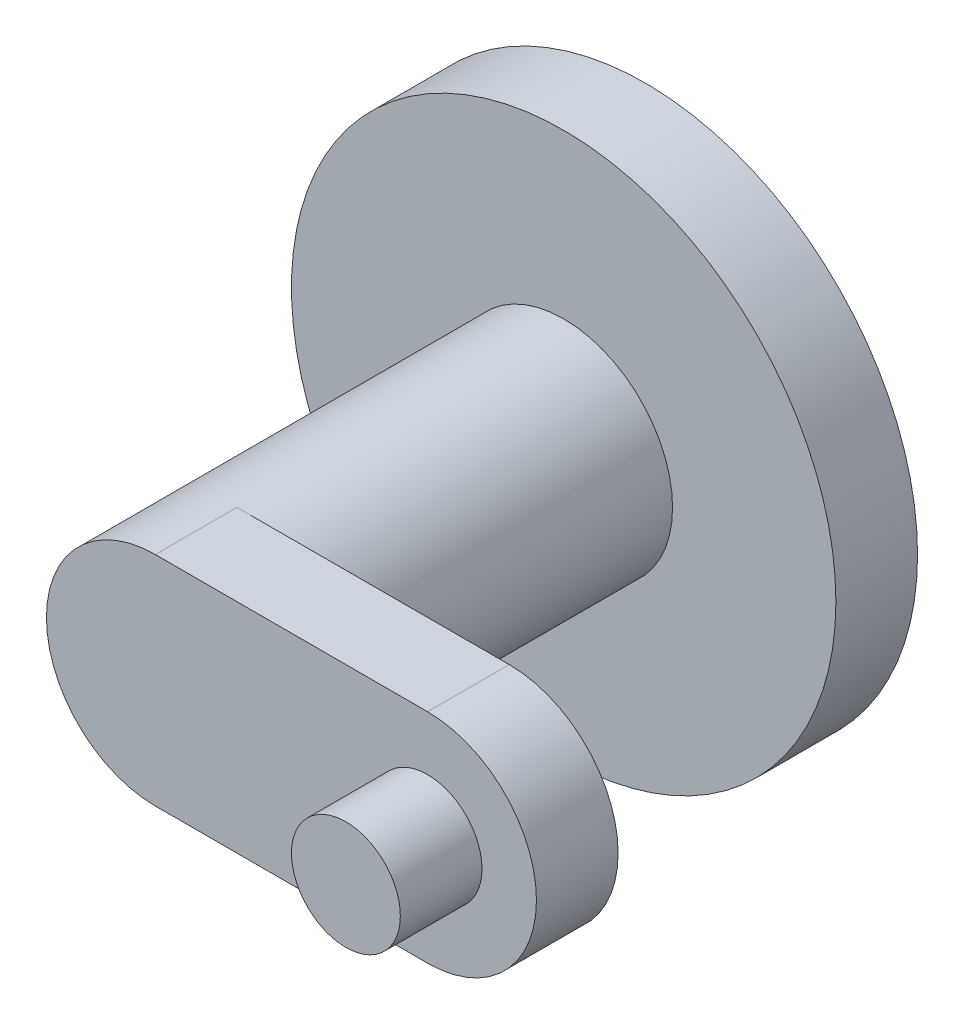
from build123d import *

# Parameters (mm, degrees)
SKETCH2_R           = 100
BOSS_EXTRUDE1_DEPTH = 30
SKETCH3_R           = 40
BOSS_EXTRUDE2_DEPTH = 150
CUT_EXTRUDE1_START  = -30
CUT_EXTRUDE1_DEPTH  = 30
BOSS_EXTRUDE6_DEPTH = 30
SKETCH6_R           = 20
BOSS_EXTRUDE7_DEPTH = 30


with BuildPart() as part:
    # Sketch2 → Boss-Extrude1 (new body)
    with BuildSketch(Plane.XY):
        Circle(SKETCH2_R)
    extrude(amount=BOSS_EXTRUDE1_DEPTH)

    # Sketch3 → Boss-Extrude2 (add)
    with BuildSketch(Plane.XY.offset(30)):
        Circle(SKETCH3_R)
    extrude(amount=BOSS_EXTRUDE2_DEPTH)

    # Sketch4 → Cut-Extrude1 (cut)
    with BuildSketch(Plane.XY.offset(180).offset(CUT_EXTRUDE1_START)):
        with BuildLine():
            Line((0, 40), (0, -40))
            ThreePointArc((0, -40), (40, 0), (0, 40))
        make_face()
    extrude(amount=CUT_EXTRUDE1_DEPTH, mode=Mode.SUBTRACT)

    # Sketch5 → Boss-Extrude6 (add)
    with BuildSketch(Plane.XY.offset(150)):
        with BuildLine():
            Line((100, 40), (0, 40))
            Line((0, 40), (0, -40))
            Line((0, -40), (100, -40))
            ThreePointArc((100, -40), (140, 0), (100, 40))
        make_face()
    extrude(amount=BOSS_EXTRUDE6_DEPTH)

    # Sketch6 → Boss-Extrude7 (add)
    with BuildSketch(Plane.XY.offset(180)):
        with Locations((100, 0)):
            Circle(SKETCH6_R)
    extrude(amount=BOSS_EXTRUDE7_DEPTH)


solid = part.part
